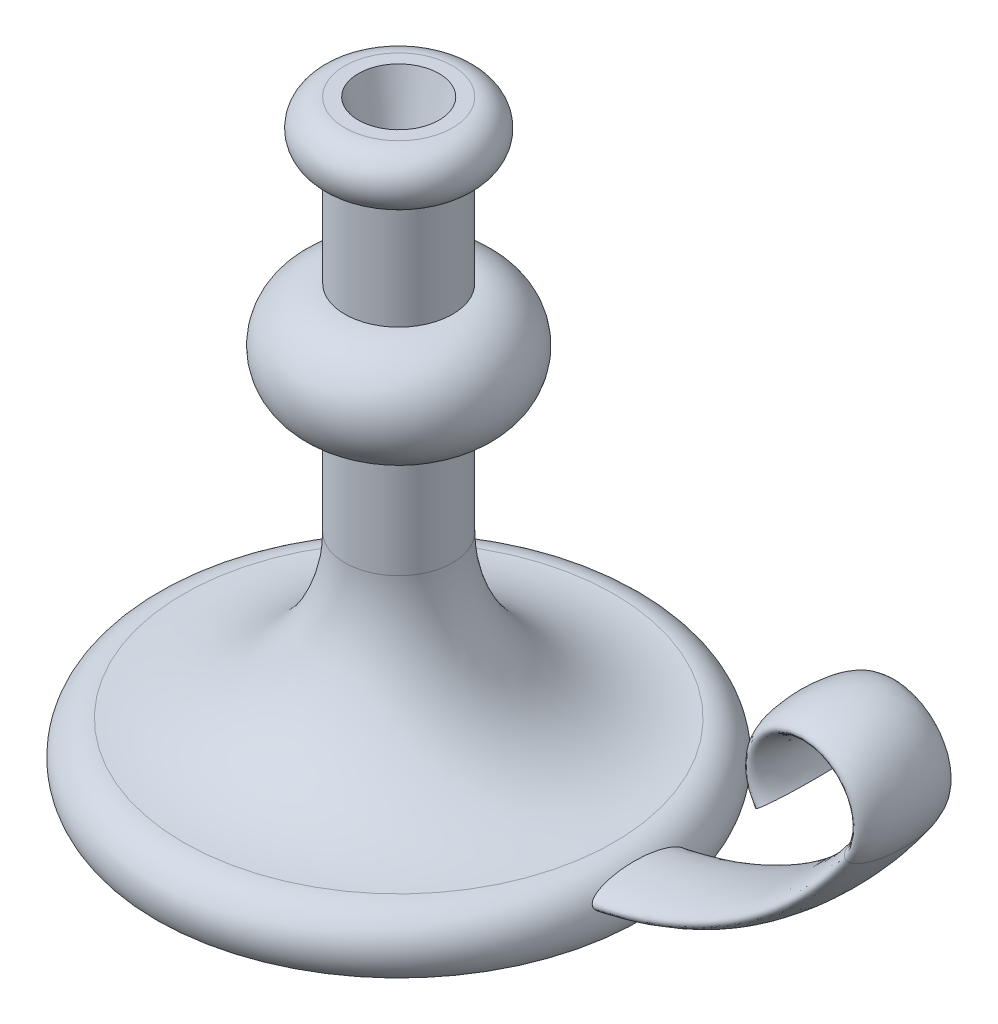
from build123d import *

# Parameters (mm, degrees)
SKETCH4_RX         = 17.5
SKETCH4_RY         = 5
SKETCH5_R          = 15
CUT_EXTRUDE1_DEPTH = 25
CUT_EXTRUDE1_DRAFT = -15


with BuildPart() as part:
    # Sketch1 → Revolve1 (revolve)
    with BuildSketch(Plane.XY, mode=Mode.PRIVATE) as revolve1_sk:
        with BuildLine():
            Line((0, 0), (0, 220))
            Line((0, 220), (20, 220))
            ThreePointArc((20, 220), (30, 210), (20, 200))
            Line((20, 200), (20, 160))
            ThreePointArc((20, 160), (40, 140), (20, 120))
            Line((20, 120), (20, 80))
            ThreePointArc((20, 80), (37.573593129, 37.573593129), (80, 20))
            ThreePointArc((80, 20), (91.180339887, 13.090169944), (90, 0))
            Line((90, 0), (0, 0))
        make_face()
    revolve(revolve1_sk.sketch.rotate(Axis((0, 0, 0), (0, 1, 0)), 90), axis=Axis((0, 0, 0), (0, 1, 0)))

    # Sweep1: sweep along a path in Sketch2
    with BuildLine(Plane.XY) as sweep1_path:
        Line((0, 10), (60, 10))
        ThreePointArc((60, 10), (129.821200219, 27.240819526), (183.592070943, 75))
        ThreePointArc((183.592070943, 75), (167.113128151, 106.333333333), (150.634185358, 75))
    # Sketch4 → Sweep1 (sweep)
    with BuildSketch(Plane(origin=(0, 0, 0), x_dir=(0, 0, -1), z_dir=(1, 0, 0))):
        with Locations((0, 10)):
            Ellipse(SKETCH4_RX, SKETCH4_RY)
    sweep(path=sweep1_path.line)


with BuildPart() as cut_extrude1_tool:
    # Sketch5 → Cut-Extrude1 (with draft: the straight prism first)
    with BuildSketch(Plane(origin=(0, 220, 0), x_dir=(1, 0, 0), z_dir=(0, 1, 0))):
        Circle(SKETCH5_R)
    extrude(amount=-CUT_EXTRUDE1_DEPTH)
    # Cut-Extrude1: the draft: its side faces are tilted about the plane it starts from
    cut_extrude1_sides = [cut_extrude1_tool.faces().sort_by_distance(p)[0] for p in [
        (-15, 207.5, 0),
    ]]
    draft(cut_extrude1_sides, Plane(origin=(0, 220, 0), x_dir=(1, 0, 0), z_dir=(0, 1, 0)), CUT_EXTRUDE1_DRAFT)


with BuildPart() as part_1:
    add(part.part)

    # Cut-Extrude1: cut by cut_extrude1_tool
    add(cut_extrude1_tool.part, mode=Mode.SUBTRACT)


solid = part_1.part
